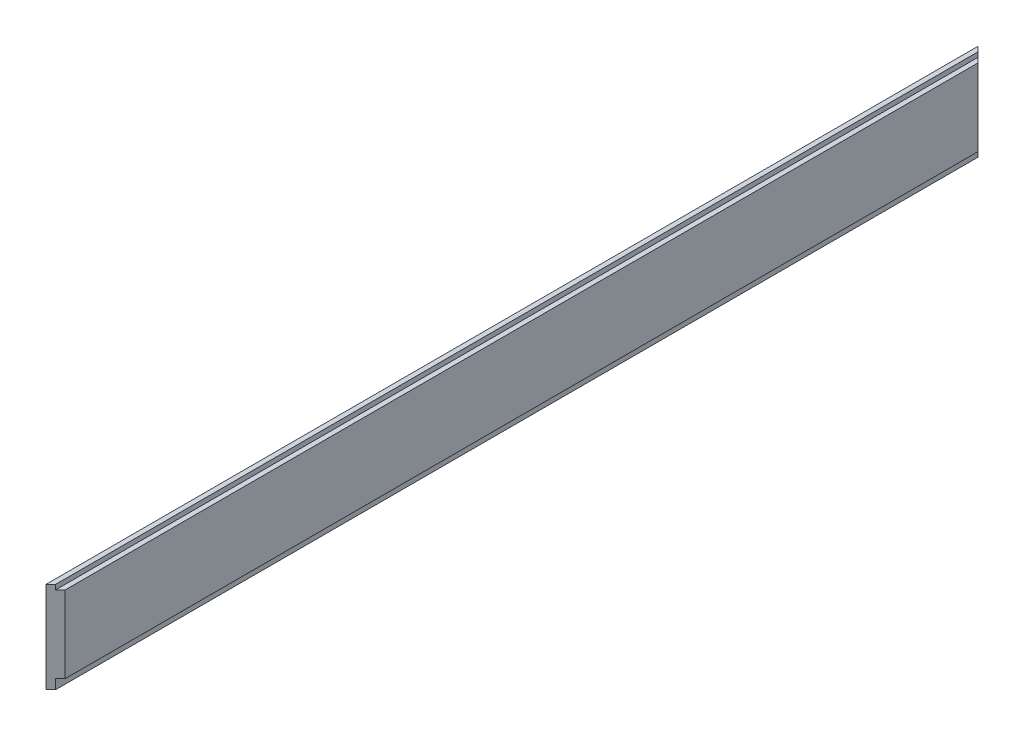
from build123d import *

# Parameters (mm, degrees)
BOSS_EXTRUDE1_DEPTH = 615.95
CUT_EXTRUDE1_DEPTH  = 619.929584545


with BuildPart() as part:
    # Sketch1 → Boss-Extrude1 (new body)
    with BuildSketch(Plane.XY):
        Polygon((0, 0), (0, 60.325), (3.175, 60.325), (3.175, 57.15), (6.35, 57.15), (6.35, 6.35), (3.175, 6.35), (3.175, 0), align=None)
    extrude(amount=BOSS_EXTRUDE1_DEPTH)

    # Sketch2 → Cut-Extrude1 (cut, through all)
    with BuildSketch(Plane(origin=(0, 60.325, 0), x_dir=(1, 0, 0), z_dir=(0, 1, 0))):
        Polygon((0, 0), (6.35, 0), (6.35, -6.35), align=None)
    cut_extrude1 = extrude(amount=-CUT_EXTRUDE1_DEPTH, mode=Mode.SUBTRACT)

    # Mirror1: Cut-Extrude1 across plane
    add(cut_extrude1.mirror(Plane.XY.offset(307.975)), mode=Mode.SUBTRACT)


solid = part.part
